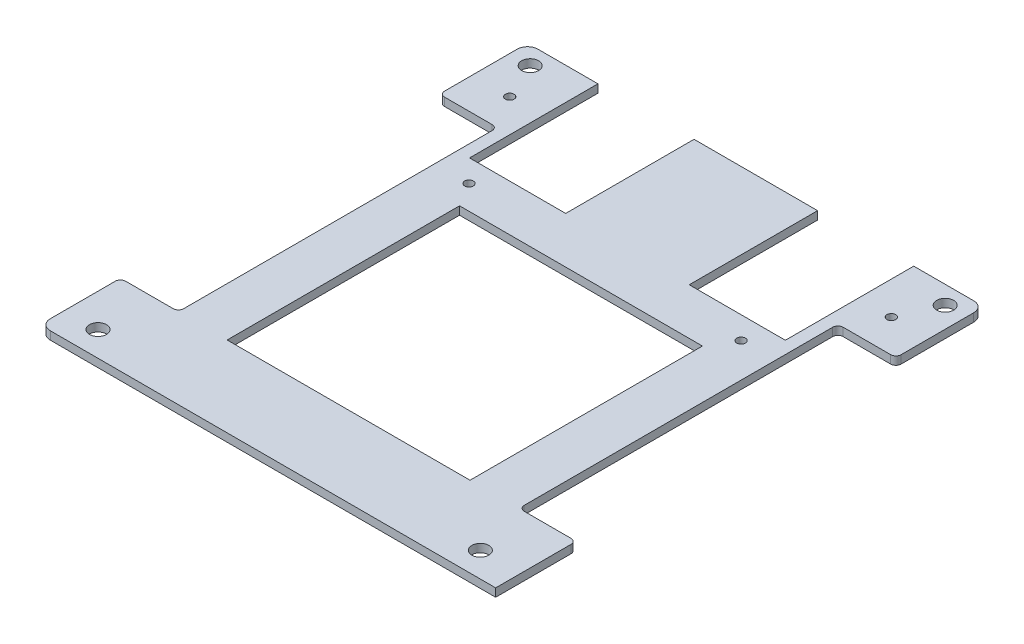
from build123d import *

# Parameters (mm, degrees)
SKETCH1_R           = 1.6383
SKETCH1_R_2         = 0.8382
BOSS_EXTRUDE1_DEPTH = 1.575
CUT_EXTRUDE1_DEPTH  = 2.54
SKETCH15_R          = 0.8382
CUT_EXTRUDE5_DEPTH  = 1.575
BOSS_EXTRUDE2_DEPTH = 1.575


with BuildPart() as part:
    # Sketch1 → Boss-Extrude1 (new body)
    with BuildSketch(Plane(origin=(0, 0, 0), x_dir=(1, 0, 0), z_dir=(0, 1, 0))):
        with BuildLine():
            Line((-44, 45), (-44, 30.998648377))
            ThreePointArc((-44, 30.998648377), (-43.707106781, 30.291541596), (-43, 29.998648377))
            Line((-43, 29.998648377), (-33.824, 29.998648377))
            ThreePointArc((-33.824, 29.998648377), (-33.116893219, 29.705755158), (-32.824, 28.998648377))
            Line((-32.824, 28.998648377), (-32.824, -30.469351623))
            ThreePointArc((-32.824, -30.469351623), (-33.116893219, -31.176458404), (-33.824, -31.469351623))
            Line((-33.824, -31.469351623), (-36.100000052, -31.469351623))
            Line((-36.100000052, -31.469351623), (-42.999999948, -31.469351623))
            ThreePointArc((-42.999999948, -31.469351623), (-43.707106729, -31.762244842), (-43.999999948, -32.469351623))
            Line((-43.999999948, -32.469351623), (-43.999999948, -38.977))
            Line((-43.999999948, -38.977), (-43.999999948, -45))
            ThreePointArc((-43.999999948, -45), (-43.41421351, -46.414213562), (-41.999999948, -47))
            Line((-41.999999948, -47), (42.705916546, -47))
            Line((42.705916546, -47), (43.849731117, -47))
            Line((43.849731117, -47), (43.849731117, -38.27))
            Line((43.849731117, -38.27), (43.849731117, -32.469351623))
            ThreePointArc((43.849731117, -32.469351623), (43.556837899, -31.762244842), (42.849731117, -31.469351623))
            Line((42.849731117, -31.469351623), (36.100000052, -31.469351623))
            Line((36.100000052, -31.469351623), (33.824, -31.469351623))
            ThreePointArc((33.824, -31.469351623), (33.116893219, -31.176458404), (32.824, -30.469351623))
            Line((32.824, -30.469351623), (32.824, 28.998648377))
            ThreePointArc((32.824, 28.998648377), (33.116893219, 29.705755158), (33.824, 29.998648377))
            Line((33.824, 29.998648377), (43, 29.998648377))
            ThreePointArc((43, 29.998648377), (43.707106781, 30.291541596), (44, 30.998648377))
            Line((44, 30.998648377), (44, 31.284))
            Line((44, 31.284), (44, 45))
            ThreePointArc((44, 45), (43.414213562, 46.414213562), (42, 47))
            Line((42, 47), (-42, 47))
            ThreePointArc((-42, 47), (-43.414213562, 46.414213562), (-44, 45))
        make_face()
        with Locations(Location((40, 43.5, 0), (0, 0, 270))):
            Circle(SKETCH1_R, mode=Mode.SUBTRACT)
        with Locations(Location((-40, 43.5, 0), (0, 0, 270))):
            Circle(SKETCH1_R, mode=Mode.SUBTRACT)
        with Locations(Location((-37.599999948, -42.2, 0), (0, 0, 270))):
            Circle(SKETCH1_R, mode=Mode.SUBTRACT)
        with Locations(Location((36.100000052, -42.2, 0), (0, 0, 270))):
            Circle(SKETCH1_R, mode=Mode.SUBTRACT)
        with Locations(Location((26.22, 17.931928709, 0), (0, 0, 270))):
            Circle(SKETCH1_R_2, mode=Mode.SUBTRACT)
        with Locations(Location((-26.22, 17.931928709, 0), (0, 0, 270))):
            Circle(SKETCH1_R_2, mode=Mode.SUBTRACT)
        Polygon((23.409, -31.5), (-23.409, -31.5), (-23.409, 13.29544), (-12.909, 13.29544), (-12.909, 25.99544), (12.909, 25.99544), (12.909, 13.29544), (23.409, 13.29544), align=None, mode=Mode.SUBTRACT)
    extrude(amount=BOSS_EXTRUDE1_DEPTH)

    # Sketch2 → Cut-Extrude1 (cut)
    with BuildSketch(Plane(origin=(0, 1.575, 0), x_dir=(1, 0, 0), z_dir=(0, 1, 0))):
        Polygon((-12.909, 19.06), (-30.435, 19.06), (-30.435, 47), (30.435, 47), (30.435, 19.06), (12.909, 19.06), (12.909, 25.99544), (-12.909, 25.99544), align=None)
    extrude(amount=-CUT_EXTRUDE1_DEPTH, mode=Mode.SUBTRACT)

    # Sketch15 → Cut-Extrude5 (cut)
    with BuildSketch(Plane(origin=(0, 1.575, 0), x_dir=(1, 0, 0), z_dir=(0, 1, 0))):
        with Locations(Location((-36.785, 36.35, 0), (0, 0, 270))):
            Circle(SKETCH15_R)
        with Locations(Location((36.785, 36.332, 0), (0, 0, 270))):
            Circle(SKETCH15_R)
    extrude(amount=-CUT_EXTRUDE5_DEPTH, mode=Mode.SUBTRACT)

    # Sketch16 → Boss-Extrude2 (add)
    with BuildSketch(Plane(origin=(0, 1.575, 0), x_dir=(1, 0, 0), z_dir=(0, 1, 0))):
        Polygon((12.909, 19.06), (12.909, 13.29544), (-12.909, 13.29544), (-12.909, 19.06), (-30.435, 19.06), (-30.435, 22.25535429), (-11.909, 22.25535429), (-11.909, 47), (11.909, 47), (11.909, 22.25535429), (30.435, 22.25535429), (30.435, 19.06), align=None)
    extrude(amount=-BOSS_EXTRUDE2_DEPTH)


solid = part.part
